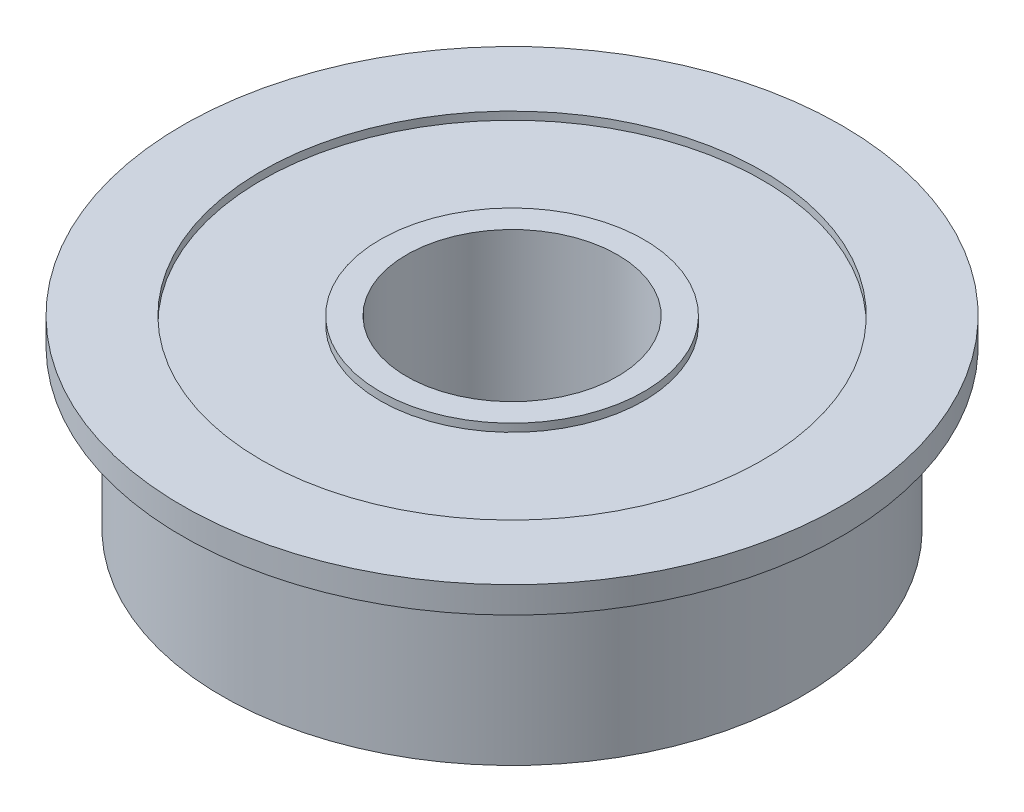
from build123d import *

# Parameters (mm, degrees)
SKETCH2_R          = 9.5
SKETCH2_R_2        = 5
CUT_EXTRUDE1_DEPTH = 0.3
CUT_EXTRUDE2_START = -0.3
SKETCH3_R          = 9.5
SKETCH3_R_2        = 5
CUT_EXTRUDE2_DEPTH = 0.3


with BuildPart() as part:
    # Sketch1 → Revolve1 (revolve)
    with BuildSketch(Plane.XY, mode=Mode.PRIVATE) as revolve1_sk:
        Polygon((-12.5, 7), (-4, 7), (-4, 0), (-11, 0), (-11, 6), (-12.5, 6), align=None)
    revolve(revolve1_sk.sketch.rotate(Axis((0, 0, 0), (0, 1, 0)), 270), axis=Axis((0, 0, 0), (0, 1, 0)))

    # Sketch2 → Cut-Extrude1 (cut)
    with BuildSketch(Plane(origin=(0, 7, 0), x_dir=(1, 0, 0), z_dir=(0, 1, 0))):
        with Locations(Location((0, 0, 0), (0, 0, 270))):
            Circle(SKETCH2_R)
        with Locations(Location((0, 0, 0), (0, 0, 270))):
            Circle(SKETCH2_R_2, mode=Mode.SUBTRACT)
    extrude(amount=-CUT_EXTRUDE1_DEPTH, mode=Mode.SUBTRACT)

    # Sketch3 → Cut-Extrude2 (cut)
    with BuildSketch(Plane.XZ.offset(CUT_EXTRUDE2_START)):
        with Locations(Location((0, 0, 0), (0, 0, 90))):
            Circle(SKETCH3_R)
        with Locations(Location((0, 0, 0), (0, 0, 90))):
            Circle(SKETCH3_R_2, mode=Mode.SUBTRACT)
    extrude(amount=CUT_EXTRUDE2_DEPTH, mode=Mode.SUBTRACT)


solid = part.part
